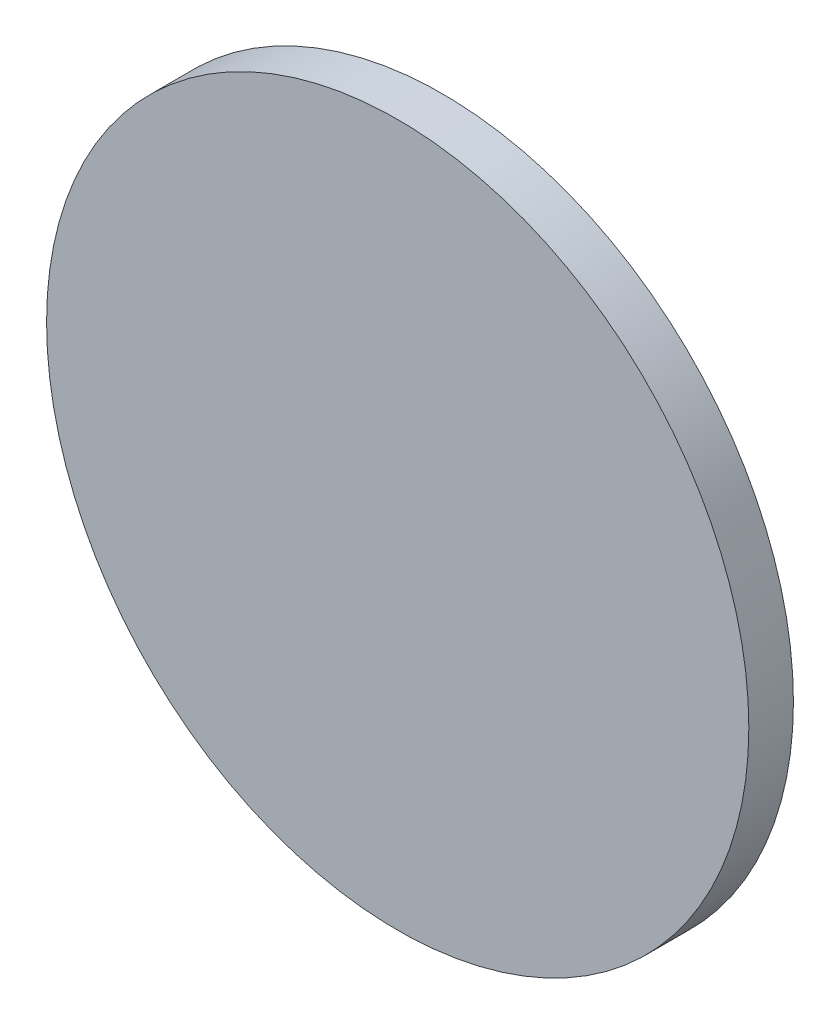
from build123d import *

# Parameters (mm, degrees)
SKETCH1_R           = 25
BOSS_EXTRUDE1_DEPTH = 3.175


with BuildPart() as part:
    # Sketch1 → Boss-Extrude1 (new body)
    with BuildSketch(Plane.XY):
        Circle(SKETCH1_R)
    extrude(amount=BOSS_EXTRUDE1_DEPTH)


solid = part.part
